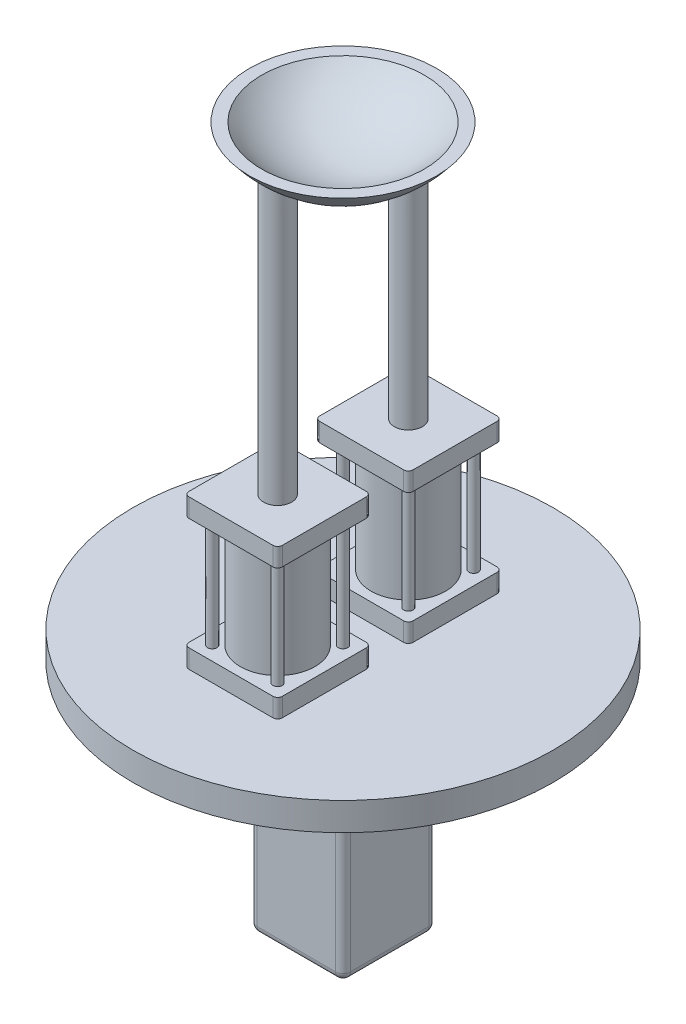
from build123d import *

# Parameters (mm, degrees)
SKETCH1_R                = 225
BOSS_EXTRUDE1_DEPTH      = 30
SHELL1_T                 = -10
SKETCH8_W                = 100
SKETCH8_H                = 100
BOSS_EXTRUDE2_DEPTH      = 20
BOSS_EXTRUDE2_2_DEPTH    = 20
SKETCH9_R                = 17.5
BOSS_EXTRUDE3_DEPTH      = 100
SKETCH11_W               = 100
SKETCH11_H               = 100
BOSS_EXTRUDE4_DEPTH      = 150
FILLET1_R                = 8
FILLET2_R                = 8
SKETCH14_R               = 40
BOSS_EXTRUDE6_DEPTH      = 120
SKETCH15_W               = 100
SKETCH15_H               = 100
BOSS_EXTRUDE7_DEPTH      = 20
BOSS_EXTRUDE8_REACH      = 545.001
BOSS_EXTRUDE8_END_RADIUS = 125
SKETCH16_R               = 15
FILLET3_R                = 5
FILLET4_R                = 5
FILLET5_R                = 5
SKETCH17_R               = 5
BOSS_EXTRUDE9_DEPTH      = 120
BOSS_EXTRUDE9_2_DEPTH    = 120
BOSS_EXTRUDE9_3_DEPTH    = 120
BOSS_EXTRUDE9_4_DEPTH    = 120


with BuildPart() as part:
    # Sketch1 → Boss-Extrude1 (new body)
    with BuildSketch(Plane(origin=(0, 0, 0), x_dir=(1, 0, 0), z_dir=(0, 1, 0))):
        with Locations(Location((0, 0, 0), (0, 0, 270))):
            Circle(SKETCH1_R)
    extrude(amount=BOSS_EXTRUDE1_DEPTH)


with BuildPart() as body_2:
    # Sketch7 → Revolve1 (revolve)
    with BuildSketch(Plane(origin=(0, 0, 0), x_dir=(0, 0, -1), z_dir=(1, 0, 0))):
        with BuildLine():
            Line((100, 500), (0, 500))
            Line((0, 500), (0, 450))
            ThreePointArc((0, 450), (55.901699437, 463.196601125), (100, 500))
        make_face()
    revolve(axis=Axis((0, 500, 0), (0, -1, 0)))

    # Shell1
    shell1_openings = [body_2.faces().sort_by_distance(p)[0] for p in [
        (0, 500, 0),
    ]]
    offset(amount=SHELL1_T, openings=shell1_openings, kind=Kind.INTERSECTION)



with BuildPart() as body_3:
    # Sketch8 → Boss-Extrude2 (new body)
    with BuildSketch(Plane(origin=(0, 30, 0), x_dir=(1, 0, 0), z_dir=(0, 1, 0))):
        with Locations((0, 70)):
            Rectangle(SKETCH8_W, SKETCH8_H)
    extrude(amount=BOSS_EXTRUDE2_DEPTH)

    # Fillet4
    fillet4_edges = [body_3.edges().sort_by_distance(p)[0] for p in [
        (50, 40, -20),
        (-50, 40, -20),
        (-50, 40, -120),
        (50, 40, -120),
    ]]
    fillet(fillet4_edges, radius=FILLET4_R)


with BuildPart() as body_4:
    # Sketch8 → Boss-Extrude2 2 (new body)
    with BuildSketch(Plane(origin=(0, 30, 0), x_dir=(1, 0, 0), z_dir=(0, 1, 0))):
        with Locations((0, -70)):
            Rectangle(SKETCH8_W, SKETCH8_H)
    extrude(amount=BOSS_EXTRUDE2_2_DEPTH)

    # Fillet5
    fillet5_edges = [body_4.edges().sort_by_distance(p)[0] for p in [
        (-50, 40, 20),
        (50, 40, 20),
        (50, 40, 120),
        (-50, 40, 120),
    ]]
    fillet(fillet5_edges, radius=FILLET5_R)


with BuildPart() as body_5:
    # Sketch9 → Boss-Extrude3 (new body)
    with BuildSketch(Plane.XZ):
        with Locations(Location((0, 0, 0), (0, 0, 270))):
            Circle(SKETCH9_R)
    extrude(amount=BOSS_EXTRUDE3_DEPTH)


with BuildPart() as body_6:
    # Sketch11 → Boss-Extrude4 (new body)
    with BuildSketch(Plane.XZ.offset(100)):
        Rectangle(SKETCH11_W, SKETCH11_H)
    extrude(amount=BOSS_EXTRUDE4_DEPTH)

    # Fillet1
    fillet1_edges = [body_6.edges().sort_by_distance(p)[0] for p in [
        (50, -175, -50),
        (-50, -175, -50),
        (-50, -175, 50),
        (50, -175, 50),
    ]]
    fillet(fillet1_edges, radius=FILLET1_R)

    # Fillet2
    fillet2_edges = [body_6.edges().sort_by_distance(p)[0] for p in [
        (-50, -250, 0),
        (0, -250, 50),
        (50, -250, 0),
        (0, -250, -50),
        (47.656854249, -250, 47.656854249),
        (47.656854249, -250, -47.656854249),
        (-47.656854249, -250, -47.656854249),
        (-47.656854249, -250, 47.656854249),
    ]]
    fillet(fillet2_edges, radius=FILLET2_R)


with BuildPart() as body_7:
    # Sketch14 → Boss-Extrude6 (new body)
    with BuildSketch(Plane(origin=(0, 50, 0), x_dir=(1, 0, 0), z_dir=(0, 1, 0))):
        with Locations(Location((0, 70, 0), (0, 0, 270))):
            Circle(SKETCH14_R)
    extrude(amount=BOSS_EXTRUDE6_DEPTH)


with BuildPart() as body_8:
    # Sketch15 → Boss-Extrude7 (new body)
    with BuildSketch(Plane(origin=(0, 170, 0), x_dir=(1, 0, 0), z_dir=(0, 1, 0))):
        with Locations((0, 70)):
            Rectangle(SKETCH15_W, SKETCH15_H)
    extrude(amount=BOSS_EXTRUDE7_DEPTH)


with BuildPart() as body_9:
    # Mirror1: mirrored copy
    add(body_8.part.mirror(Plane.XY))


with BuildPart() as body_10:
    # Mirror1 2: mirrored copy
    add(body_7.part.mirror(Plane.XY))


with BuildPart() as body_2_1:
    add(body_2.part)

    add(body_8.part)  # Boss-Extrude8 merges body 8

    add(body_9.part)  # Boss-Extrude8 merges body 9
    # Boss-Extrude8: up to this sphere (the profile starts outside it)
    boss_extrude8_end = Location((0, 575, 0)) * Sphere(BOSS_EXTRUDE8_END_RADIUS, mode=Mode.PRIVATE)
    # Sketch16 → Boss-Extrude8 (add, up to the surface)
    with BuildSketch(Plane(origin=(0, 190, 0), x_dir=(1, 0, 0), z_dir=(0, 1, 0)), mode=Mode.PRIVATE) as boss_extrude8_sk1:
        with Locations(Location((0, 70, 0), (0, 0, 270))):
            Circle(SKETCH16_R)
    boss_extrude8_tool1 = extrude(boss_extrude8_sk1.sketch, amount=BOSS_EXTRUDE8_REACH, mode=Mode.PRIVATE) - boss_extrude8_end
    add(boss_extrude8_tool1.solids().sort_by_distance((0, 190, -70))[0])
    # Sketch16 → Boss-Extrude8 (add, up to the surface)
    with BuildSketch(Plane(origin=(0, 190, 0), x_dir=(1, 0, 0), z_dir=(0, 1, 0)), mode=Mode.PRIVATE) as boss_extrude8_sk2:
        with Locations(Location((0, -70, 0), (0, 0, 90))):
            Circle(SKETCH16_R)
    boss_extrude8_tool2 = extrude(boss_extrude8_sk2.sketch, amount=BOSS_EXTRUDE8_REACH, mode=Mode.PRIVATE) - boss_extrude8_end
    add(boss_extrude8_tool2.solids().sort_by_distance((0, 190, 70))[0])

    # Fillet3
    fillet3_edges = [body_2_1.edges().sort_by_distance(p)[0] for p in [
        (-50, 180, -120),
        (-50, 180, -20),
        (50, 180, -20),
        (50, 180, -120),
        (-50, 180, 20),
        (50, 180, 20),
        (50, 180, 120),
        (-50, 180, 120),
    ]]
    fillet(fillet3_edges, radius=FILLET3_R)


with BuildPart() as body_9_2:
    # Sketch17 → Boss-Extrude9 (new body)
    with BuildSketch(Plane(origin=(0, 50, 0), x_dir=(1, 0, 0), z_dir=(0, 1, 0))):
        with Locations(Location((-35, 105, 0), (0, 0, 270))):
            Circle(SKETCH17_R)
    extrude(amount=BOSS_EXTRUDE9_DEPTH)


with BuildPart() as body_10_2:
    # Sketch17 → Boss-Extrude9 2 (new body)
    with BuildSketch(Plane(origin=(0, 50, 0), x_dir=(1, 0, 0), z_dir=(0, 1, 0))):
        with Locations(Location((35, 105, 0), (0, 0, 90))):
            Circle(SKETCH17_R)
    extrude(amount=BOSS_EXTRUDE9_2_DEPTH)


with BuildPart() as body_11:
    # Sketch17 → Boss-Extrude9 3 (new body)
    with BuildSketch(Plane(origin=(0, 50, 0), x_dir=(1, 0, 0), z_dir=(0, 1, 0))):
        with Locations(Location((35, 35, 0), (0, 0, 270))):
            Circle(SKETCH17_R)
    extrude(amount=BOSS_EXTRUDE9_3_DEPTH)


with BuildPart() as body_12:
    # Sketch17 → Boss-Extrude9 4 (new body)
    with BuildSketch(Plane(origin=(0, 50, 0), x_dir=(1, 0, 0), z_dir=(0, 1, 0))):
        with Locations(Location((-35, 35, 0), (0, 0, 90))):
            Circle(SKETCH17_R)
    extrude(amount=BOSS_EXTRUDE9_4_DEPTH)


with BuildPart() as body_13:
    # Mirror3: mirrored copy
    add(body_9_2.part.mirror(Plane.XY))


with BuildPart() as body_14:
    # Mirror3 2: mirrored copy
    add(body_12.part.mirror(Plane.XY))


with BuildPart() as body_15:
    # Mirror3 3: mirrored copy
    add(body_11.part.mirror(Plane.XY))


with BuildPart() as body_16:
    # Mirror3 4: mirrored copy
    add(body_10_2.part.mirror(Plane.XY))


solid = Compound([part.part, body_3.part, body_4.part, body_5.part, body_6.part, body_7.part, body_10.part, body_2_1.part, body_9_2.part, body_10_2.part, body_11.part, body_12.part, body_13.part, body_14.part, body_15.part, body_16.part])
